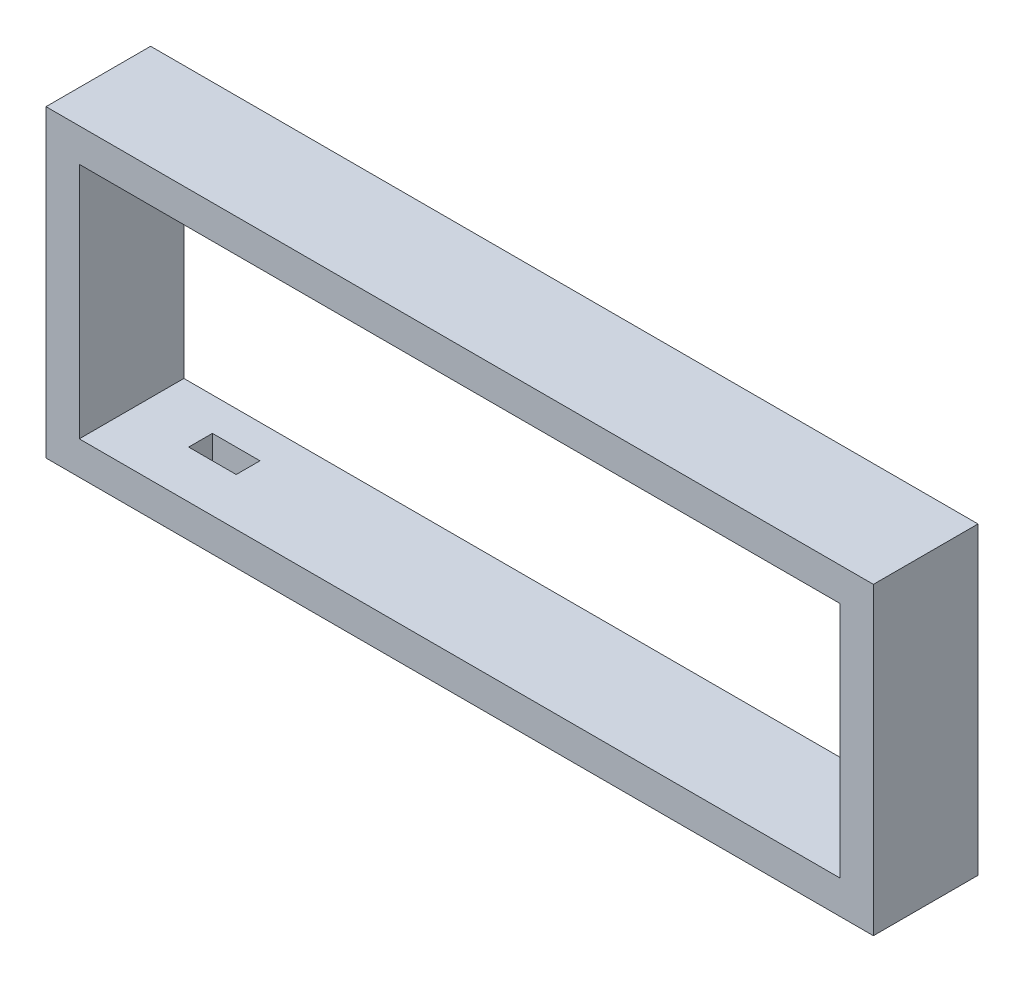
from build123d import *

# Parameters (mm, degrees)
SKICA1_W                 = 174
SKICA1_H                 = 64
SKICA1_W_2               = 160
SKICA1_H_2               = 50
P_IDAT_VYSUNUT_M1_DEPTH  = 2
SKICA2_W                 = 174
SKICA2_H                 = 64
SKICA2_W_2               = 160
SKICA2_H_2               = 50
P_IDAT_VYSUNUT_M2_DEPTH  = 20
SKICA3_W                 = 10
SKICA3_H                 = 5
ODEBRAT_VYSUNUT_M1_DEPTH = 178.825757414


with BuildPart() as part:
    # Skica1 → Přidat vysunutím1 (new body)
    with BuildSketch(Plane.XY):
        with Locations((80, 25)):
            Rectangle(SKICA1_W, SKICA1_H)
        with Locations((80, 25)):
            Rectangle(SKICA1_W_2, SKICA1_H_2, mode=Mode.SUBTRACT)
    extrude(amount=P_IDAT_VYSUNUT_M1_DEPTH)

    # Skica2 → Přidat vysunutím2 (add)
    with BuildSketch(Plane.XY.offset(2)):
        with Locations((80, 25)):
            Rectangle(SKICA2_W, SKICA2_H)
        with Locations((80, 25)):
            Rectangle(SKICA2_W_2, SKICA2_H_2, mode=Mode.SUBTRACT)
    extrude(amount=P_IDAT_VYSUNUT_M2_DEPTH)

    # Skica3 → Odebrat vysunutím1 (cut, through all)
    with BuildSketch(Plane(origin=(0, 0, 0), x_dir=(1, 0, 0), z_dir=(0, 1, 0))):
        with Locations((18, -9.5)):
            Rectangle(SKICA3_W, SKICA3_H)
    extrude(amount=-ODEBRAT_VYSUNUT_M1_DEPTH, mode=Mode.SUBTRACT)


solid = part.part
